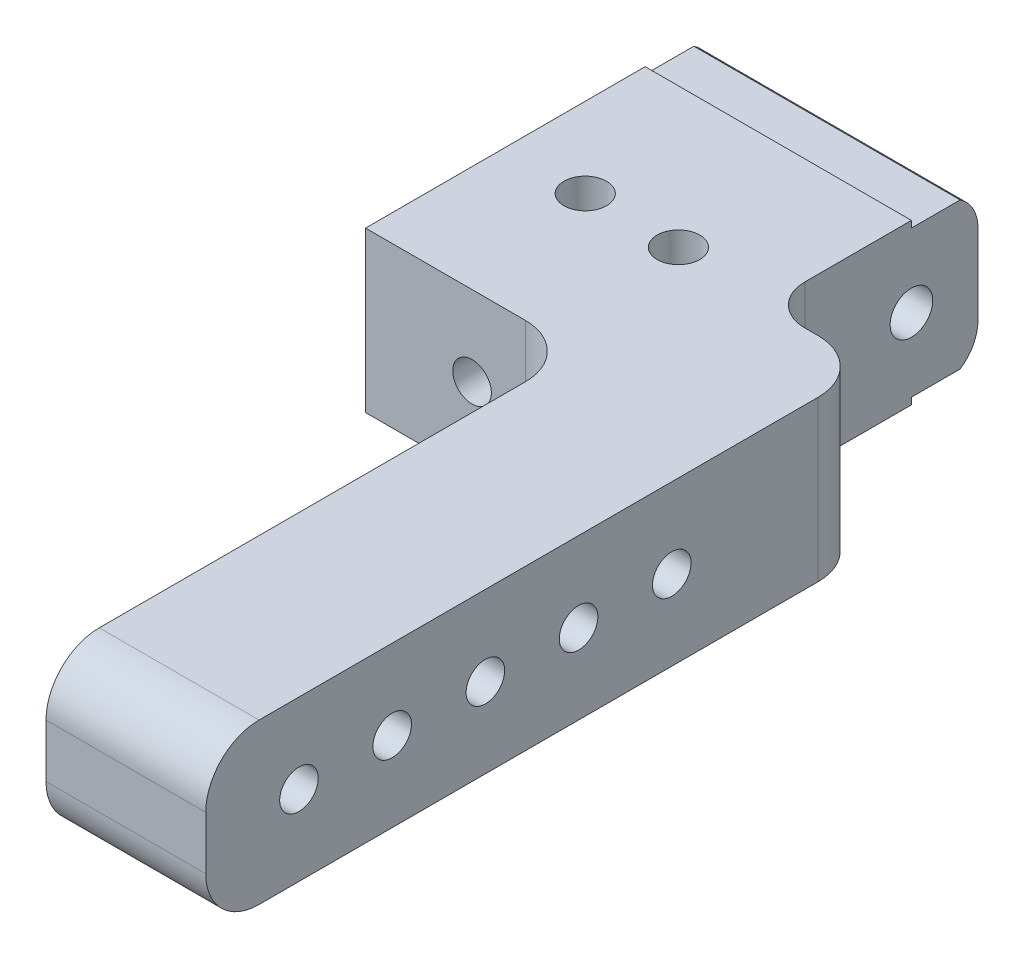
from build123d import *

# Parameters (mm, degrees)
SKETCH1_W           = 20
SKETCH1_H           = 12
BOSS_EXTRUDE1_DEPTH = 26
SKETCH2_W           = 10
SKETCH2_H           = 12
BOSS_EXTRUDE2_DEPTH = 8
SKETCH4_R           = 1.6
CUT_EXTRUDE2_DEPTH  = 41.049968789
FILLET1_R           = 3
FILLET3_R           = 3
SKETCH5_W           = 9.976745634
SKETCH5_H           = 0.5
SKETCH5_W_2         = 12.25993895
CUT_EXTRUDE3_DEPTH  = 41.049968789
SKETCH6_W           = 5.5
SKETCH6_H           = 30.488056323
CUT_EXTRUDE4_DEPTH  = 0.8
SKETCH8_W           = 12
SKETCH8_H           = 12
BOSS_EXTRUDE3_DEPTH = 40
SKETCH3_R           = 1.6
CUT_EXTRUDE1_DEPTH  = 73.691127382
SKETCH9_R           = 1.45
CUT_EXTRUDE6_DEPTH  = 12
FILLET4_R           = 4
SKETCH10_R          = 1.45
CUT_EXTRUDE7_DEPTH  = 12
FILLET5_R           = 4
FILLET7_R           = 4


with BuildPart() as part:
    # Sketch1 → Boss-Extrude1 (new body)
    with BuildSketch(Plane.XY):
        with Locations((10, -6)):
            Rectangle(SKETCH1_W, SKETCH1_H)
    extrude(amount=BOSS_EXTRUDE1_DEPTH)

    # Sketch2 → Boss-Extrude2 (add)
    with BuildSketch(Plane(origin=(20, 0, 0), x_dir=(0, 0, -1), z_dir=(1, 0, 0))):
        with Locations((-21, -6)):
            Rectangle(SKETCH2_W, SKETCH2_H)
    extrude(amount=BOSS_EXTRUDE2_DEPTH)

    # Sketch4 → Cut-Extrude2 (cut, through all)
    with BuildSketch(Plane(origin=(0, 0, 0), x_dir=(1, 0, 0), z_dir=(0, 1, 0))):
        with Locations(Location((13, -15.5, 0), (0, 0, 270))):
            Circle(SKETCH4_R)
        with Locations(Location((6, -15.5, 0), (0, 0, 270))):
            Circle(SKETCH4_R)
    extrude(amount=-CUT_EXTRUDE2_DEPTH, mode=Mode.SUBTRACT)

    # Fillet1
    fillet1_edges = [part.edges().sort_by_distance(p)[0] for p in [
        (20, -6, 16),
    ]]
    fillet(fillet1_edges, radius=FILLET1_R)

    # Fillet3
    fillet3_edges = [part.edges().sort_by_distance(p)[0] for p in [
        (10, 0, 0),
        (10, -12, 0),
    ]]
    fillet(fillet3_edges, radius=FILLET3_R)

    # Sketch5 → Cut-Extrude3 (cut, through all)
    with BuildSketch(Plane.ZY):
        with Locations((0.011627183, -11.75)):
            Rectangle(SKETCH5_W, SKETCH5_H)
        with Locations((-1.129969475, -0.25)):
            Rectangle(SKETCH5_W_2, SKETCH5_H)
    extrude(amount=-CUT_EXTRUDE3_DEPTH, mode=Mode.SUBTRACT)

    # Sketch6 → Cut-Extrude4 (cut)
    with BuildSketch(Plane(origin=(0, 0, 0), x_dir=(-1, 0, 0), z_dir=(0, 0, -1))):
        with Locations((-10, -7.868232937)):
            Rectangle(SKETCH6_W, SKETCH6_H)
    extrude(amount=-CUT_EXTRUDE4_DEPTH, mode=Mode.SUBTRACT)

    # Sketch8 → Boss-Extrude3 (add)
    with BuildSketch(Plane.XY.offset(26)):
        with Locations((22, -6)):
            Rectangle(SKETCH8_W, SKETCH8_H)
    extrude(amount=BOSS_EXTRUDE3_DEPTH)

    # Sketch3 → Cut-Extrude1 (cut, through all)
    with BuildSketch(Plane.ZY):
        with Locations(Location((5, -6, 0), (0, 0, 270))):
            Circle(SKETCH3_R)
    extrude(amount=-CUT_EXTRUDE1_DEPTH, mode=Mode.SUBTRACT)

    # Sketch9 → Cut-Extrude6 (cut)
    with BuildSketch(Plane(origin=(28, 0, 0), x_dir=(0, 0, -1), z_dir=(1, 0, 0))):
        with Locations((-31, -6)):
            Circle(SKETCH9_R)
        with Locations((-38, -6)):
            Circle(SKETCH9_R)
        with Locations((-45, -6)):
            Circle(SKETCH9_R)
        with Locations((-52, -6)):
            Circle(SKETCH9_R)
        with Locations((-59, -6)):
            Circle(SKETCH9_R)
    extrude(amount=-CUT_EXTRUDE6_DEPTH, mode=Mode.SUBTRACT)

    # Fillet4
    fillet4_edges = [part.edges().sort_by_distance(p)[0] for p in [
        (16, -6, 26),
    ]]
    fillet(fillet4_edges, radius=FILLET4_R)

    # Sketch10 → Cut-Extrude7 (cut)
    with BuildSketch(Plane.XY.offset(26)):
        with Locations((8, -6)):
            Circle(SKETCH10_R)
    extrude(amount=-CUT_EXTRUDE7_DEPTH, mode=Mode.SUBTRACT)

    # Fillet5
    fillet5_edges = [part.edges().sort_by_distance(p)[0] for p in [
        (28, -6, 16),
    ]]
    fillet(fillet5_edges, radius=FILLET5_R)

    # Fillet7
    fillet7_edges = [part.edges().sort_by_distance(p)[0] for p in [
        (22, 0, 66),
        (22, -12, 66),
    ]]
    fillet(fillet7_edges, radius=FILLET7_R)


solid = part.part
